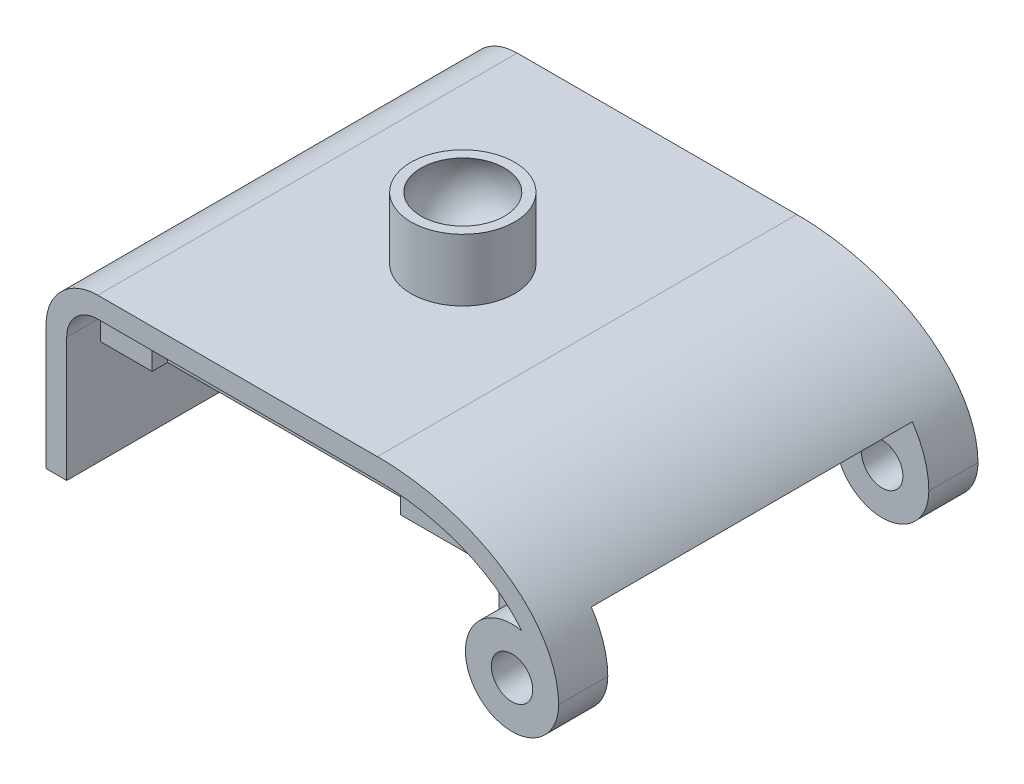
from build123d import *

# Parameters (mm, degrees)
EXTRUDE_1_DEPTH                 = 37.25
EXTRUDE_1_DEPTH_BACK            = 3.25
EXTRUDE_2_DEPTH                 = 34
SKETCH_4_W                      = 24
SKETCH_4_H                      = 3
CUT_EXTRUDE_2_DEPTH             = 1.5
SKETCH_5_W                      = 24
SKETCH_5_H                      = 3
CUT_EXTRUDE_3_DEPTH             = 1.5
CUT_EXTRUDE_4_DEPTH             = 1
SKETCH_8_R                      = 5
EXTRUDE_3_DEPTH                 = 6
CUT_EXTRUDE_5_REACH             = 60.218
CUT_EXTRUDE_5_DIRECTION_2_REACH = 60.218
CUT_EXTRUDE_START               = -40.5
SKETCH_11_R                     = 2
CUT_EXTRUDE_6_DEPTH             = 40.5
FILLET_1_R                      = 1


with BuildPart() as part:
    # 草图1 → 凸台-拉伸1 (new, two sides: drawn at the far end of the back side and taken through both)
    with BuildSketch(Plane.XY.offset(-EXTRUDE_1_DEPTH_BACK)):
        with BuildLine():
            Line((0, 0), (0, 12))
            ThreePointArc((0, 12), (1.464466094, 15.535533906), (5, 17))
            Line((5, 17), (32, 17))
            add(Edge.make_bspline(
                [(49.5, 5), (49.5, 17), (32, 17)],
                knots=[0, 0, 0, 1.570796327, 1.570796327, 1.570796327], degree=2, weights=[1, 0.707106781, 1]))
            ThreePointArc((49.5, 5), (41.509702911, 2.159608084), (45.914299452, 9.406138504))
            add(Edge.make_bspline(
                [(45.914299452, 9.406138504), (41.65859064, 15), (32, 15)],
                knots=[0.456282365, 0.456282365, 0.456282365, 1.570796327, 1.570796327, 1.570796327], degree=2, weights=[1, 0.848708976, 1]))
            Line((32, 15), (5, 15))
            ThreePointArc((5, 15), (2.878679656, 14.121320344), (2, 12))
            Line((2, 12), (2, 0))
            Line((2, 0), (0, 0))
        make_face()
    extrude(amount=EXTRUDE_1_DEPTH + EXTRUDE_1_DEPTH_BACK)

    # 草图3 → 凸台-拉伸2 (add)
    with BuildSketch(Plane.XY):
        with BuildLine():
            Line((2, 10), (2, 12))
            ThreePointArc((2, 12), (2.878679656, 14.121320344), (5, 15))
            Line((5, 15), (34, 15))
            Line((34, 15), (39.104860956, 15.703804603))
            Line((39.104860956, 15.703804603), (46.11459578, 11.473026606))
            Line((46.11459578, 11.473026606), (46.11459578, 10))
            Line((46.11459578, 10), (46.11459578, 5))
            Line((46.11459578, 5), (40.5, 5))
            Line((40.5, 5), (40.5, 9))
            Line((40.5, 9), (40.5, 10))
            Line((40.5, 10), (39.5, 10))
            Line((39.5, 10), (2, 10))
        make_face()
    extrude(amount=EXTRUDE_2_DEPTH)

    # 草图4 → 切除-拉伸2 (cut)
    with BuildSketch(Plane.XY):
        with Locations((19, 11.5)):
            Rectangle(SKETCH_4_W, SKETCH_4_H)
    extrude(amount=CUT_EXTRUDE_2_DEPTH, mode=Mode.SUBTRACT)

    # 草图5 → 切除-拉伸3 (cut)
    with BuildSketch(Plane.XY.offset(34)):
        with Locations((19, 11.5)):
            Rectangle(SKETCH_5_W, SKETCH_5_H)
    extrude(amount=-CUT_EXTRUDE_3_DEPTH, mode=Mode.SUBTRACT)

    # 草图6 → 切除-拉伸4 (cut)
    # profile 1 of 9: a face of its own
    with BuildSketch(Plane.ZY):
        with BuildLine():
            Line((17.062486682, 6.337097805), (17.127370552, 6.433304922))
            add(Edge.make_bspline(
                [(17.127370552, 6.433304922), (17.13666404, 6.4476645), (17.156985051, 6.479062953), (17.187800343, 6.531491014), (17.224095239, 6.592103365), (17.263951839, 6.661817271), (17.307836793, 6.740330668), (17.356736596, 6.827104586), (17.409285461, 6.922903534), (17.483990324, 7.060275708), (17.5751702, 7.23301731), (17.671287899, 7.438146499), (17.753388195, 7.634484637), (17.808981405, 7.792570319), (17.845884737, 7.910526564), (17.870704003, 7.986949933), (17.891449926, 8.053695194), (17.909468991, 8.110013034), (17.923576583, 8.156269858), (17.934395967, 8.192221734), (17.940903962, 8.218200076), (17.946868619, 8.242168486), (17.951829208, 8.274339562), (17.957926841, 8.323702425), (17.968429934, 8.391397351), (17.97475836, 8.442693711), (17.978318773, 8.471553377)],
                knots=[0, 0, 0, 0, 0.553378109, 1.210008858, 1.967352689, 2.839338893, 3.808124234, 4.877689115, 6.062102734, 7.343445452, 9.937410549, 12.380698025, 14.67067034, 16.820375242, 17.799754887, 18.669735412, 19.420213662, 20.061288848, 20.582887815, 20.985070831, 21.275757631, 21.449396392, 21.783958517, 22.327724234, 23.059166779, 24, 24, 24, 24], degree=3))
            Line((17.978318773, 8.471553377), (18.023812061, 8.471553377))
            Line((18.023812061, 8.471553377), (18.190123588, 8.048689538))
            add(Edge.make_bspline(
                [(18.190123588, 8.048689538), (18.171166424, 8.034993244), (18.137836461, 8.010912798), (18.1034282, 7.978719888), (18.085903374, 7.951817891), (18.072892568, 7.928698811), (18.054774603, 7.896496612), (18.032521209, 7.854661078), (18.005875067, 7.803344061), (17.974360379, 7.742784505), (17.938616992, 7.672650498), (17.885996928, 7.568197552), (17.819651705, 7.436177567), (17.742999384, 7.282706602), (17.669811963, 7.140313467), (17.611837328, 7.025968309), (17.5638027, 6.936076275), (17.522293896, 6.865231943), (17.476475125, 6.78880317), (17.422922979, 6.708680653), (17.364857543, 6.622840925), (17.30138362, 6.531722138), (17.232232126, 6.435589907), (17.183187006, 6.370561782), (17.157948008, 6.337097805)],
                knots=[0, 0, 0, 0, 0.769221431, 1.352423861, 1.529074247, 1.821788066, 2.22390053, 2.742661439, 3.378168602, 4.123215797, 4.985070903, 5.963759388, 7.96494763, 9.838323195, 11.598550095, 13.223702461, 14.049404432, 14.945770044, 15.92046477, 16.975859457, 18.110534635, 19.324695451, 20.623267581, 22, 22, 22, 22], degree=3))
            Line((17.157948008, 6.337097805), (17.107234179, 6.266993394))
            Line((17.107234179, 6.266993394), (17.062486682, 6.337097805))
        make_face()
    # profile 2 of 9: a face of its own
    with BuildSketch(Plane.ZY):
        with BuildLine():
            Line((17.968623482, 6.06040912), (18.003675687, 6.135734072))
            Line((18.003675687, 6.135734072), (18.08422118, 6.06040912))
            Line((18.08422118, 6.06040912), (18.375825698, 5.813552099))
            add(Edge.make_bspline(
                [(18.375825698, 5.813552099), (18.392736234, 5.798532725), (18.421573818, 5.772920143), (18.460367234, 5.744671715), (18.481394463, 5.72383136), (18.493603612, 5.719235288), (18.496643938, 5.718090773)],
                knots=[0, 0, 0, 0, 1.754127975, 2.991319391, 3.748818111, 4, 4, 4, 4], degree=3))
            add(Edge.make_bspline(
                [(18.496643938, 5.718090773), (18.49829884, 5.720771278), (18.504344137, 5.730563063), (18.503570649, 5.749330807), (18.505618619, 5.772277877), (18.509254101, 5.797574471), (18.51046535, 5.82903188), (18.515407648, 5.867408312), (18.517612894, 5.915723397), (18.521385386, 5.975835374), (18.521056581, 6.049230454), (18.521668928, 6.10242506), (18.522000852, 6.131259322)],
                knots=[0, 0, 0, 0, 0.225086146, 0.822231528, 1.290670906, 1.905653388, 2.6620565, 3.564727791, 4.698727915, 6.155571278, 7.916118279, 10, 10, 10, 10], degree=3))
            Line((18.522000852, 6.131259322), (18.522000852, 9.317281057))
            add(Edge.make_bspline(
                [(18.522000852, 9.317281057), (18.521772702, 9.360308256), (18.521326501, 9.444457869), (18.51211632, 9.565494158), (18.502558549, 9.673729954), (18.491976315, 9.755253473), (18.481751494, 9.815915893), (18.471004239, 9.864610815), (18.457587978, 9.919073775), (18.447026447, 9.957197036), (18.441455359, 9.977306627)],
                knots=[0, 0, 0, 0, 1.547346178, 3.026192341, 4.364546397, 5.456050829, 5.982389205, 6.577004877, 7.249386116, 8, 8, 8, 8], degree=3))
            Line((18.441455359, 9.977306627), (18.481728106, 10.022054123))
            Line((18.481728106, 10.022054123), (18.778553164, 9.614851907))
            add(Edge.make_bspline(
                [(18.778553164, 9.614851907), (18.76994435, 9.598278179), (18.754820538, 9.56916175), (18.73515032, 9.526183696), (18.720252804, 9.479434531), (18.707794781, 9.423123568), (18.694568032, 9.358863018), (18.685654104, 9.301583681), (18.681933061, 9.250445281), (18.679802032, 9.201702965), (18.678387574, 9.142275954), (18.678052366, 9.099013499), (18.677871298, 9.075644577)],
                knots=[0, 0, 0, 0, 1.009758074, 1.773924959, 2.551680179, 3.656752826, 4.890268125, 6.099082517, 6.786605503, 7.661107465, 8.736608971, 10, 10, 10, 10], degree=3))
            Line((18.677871298, 9.075644577), (18.677871298, 6))
            add(Edge.make_bspline(
                [(18.677871298, 6), (18.677583554, 5.953756509), (18.677048182, 5.867716554), (18.673294052, 5.748615615), (18.66815286, 5.648774469), (18.655971227, 5.543227571), (18.637661758, 5.427960925), (18.615339332, 5.322012265), (18.599502075, 5.248740809), (18.587132785, 5.210386667), (18.581324248, 5.187669424), (18.568951442, 5.172881506), (18.555296916, 5.185673257), (18.550247277, 5.194636596), (18.547357767, 5.199765608)],
                knots=[0, 0, 0, 0, 1.914653359, 3.562375758, 4.933851041, 6.052362095, 7.959530355, 9.766250594, 10.527741695, 11.07493174, 11.40751651, 11.545997894, 11.740210362, 12, 12, 12, 12], degree=3))
            Line((18.547357767, 5.199765608), (18.512305561, 5.26539527))
            Line((18.512305561, 5.26539527), (18.38626678, 5.471233752))
            Line((18.38626678, 5.471233752), (18.225175794, 5.723311315))
            Line((18.225175794, 5.723311315), (18.023812061, 5.990304709))
            Line((18.023812061, 5.990304709), (17.968623482, 6.06040912))
        make_face()
    # profile 3 of 9: a face of its own
    with BuildSketch(Plane.ZY):
        with BuildLine():
            Line((19.040326017, 8.36117622), (19.080598764, 8.416364799))
            Line((19.080598764, 8.416364799), (19.105955679, 8.381312593))
            Line((19.105955679, 8.381312593), (19.41322182, 7.953228212))
            Line((19.41322182, 7.953228212), (19.614585553, 7.641487322))
            Line((19.614585553, 7.641487322), (19.865917324, 7.218623482))
            Line((19.865917324, 7.218623482), (19.946462817, 7.072448327))
            Line((19.946462817, 7.072448327), (19.997176646, 6.966545919))
            add(Edge.make_bspline(
                [(19.997176646, 6.966545919), (20.002656756, 6.953712315), (20.012555882, 6.93053003), (20.02232865, 6.898525682), (20.029951686, 6.874656153), (20.033477966, 6.85025754), (20.029494993, 6.817893856), (20.025145305, 6.791482068), (20.022533561, 6.775623269)],
                knots=[0, 0, 0, 0, 1.271526692, 2.29685232, 3.050548467, 3.553977915, 4.531300672, 6, 6, 6, 6], degree=3))
            Line((20.022533561, 6.775623269), (19.991956105, 6.66450032))
            Line((19.991956105, 6.66450032), (19.951683358, 6.548902621))
            add(Edge.make_bspline(
                [(19.951683358, 6.548902621), (19.947774078, 6.536303646), (19.941083228, 6.514740125), (19.928922692, 6.488973609), (19.918570751, 6.471278218), (19.899666869, 6.46563194), (19.881289696, 6.485067673), (19.878187362, 6.503175242), (19.876358406, 6.513850416)],
                knots=[0, 0, 0, 0, 1.537433221, 2.631362767, 3.376993712, 3.828933445, 4.720064953, 6, 6, 6, 6], degree=3))
            Line((19.876358406, 6.513850416), (19.861442574, 6.574259535))
            add(Edge.make_bspline(
                [(19.861442574, 6.574259535), (19.858776512, 6.583975157), (19.852656441, 6.60627782), (19.84045768, 6.643504199), (19.824871536, 6.688779278), (19.805451451, 6.742076964), (19.781119798, 6.802862133), (19.754775591, 6.872614873), (19.723026565, 6.949562807), (19.689969052, 7.032900139), (19.654590406, 7.11683497), (19.621850359, 7.198435671), (19.58813095, 7.273305095), (19.558999816, 7.344036366), (19.5296632, 7.408349261), (19.502840554, 7.467639383), (19.477758046, 7.521233127), (19.431816514, 7.611881877), (19.369723801, 7.736464378), (19.290380952, 7.889082111), (19.220099259, 8.023390948), (19.165730662, 8.121948084), (19.128887297, 8.189663783), (19.108488412, 8.229689395), (19.09219796, 8.260458192), (19.084018894, 8.278363886), (19.080598764, 8.285851268)],
                knots=[0, 0, 0, 0, 0.384963827, 0.883702394, 1.496595004, 2.214914151, 3.05114879, 3.998553938, 5.064103531, 6.231973038, 7.424618756, 8.544919074, 9.591539058, 10.562049879, 11.467814365, 12.292583888, 13.049029966, 13.728809879, 16.176032318, 18.368524255, 20.302115207, 21.968637812, 22.669982638, 23.247858041, 23.685486984, 24, 24, 24, 24], degree=3))
            Line((19.080598764, 8.285851268), (19.040326017, 8.36117622))
        make_face()
    # profile 4 of 9: a face of its own
    with BuildSketch(Plane.ZY):
        with BuildLine():
            add(Edge.make_bspline(
                [(21.449978692, 7.93831238), (21.464912866, 7.91669968), (21.491997267, 7.877503201), (21.530639521, 7.820987793), (21.561223553, 7.76064135), (21.580496259, 7.68680228), (21.595634195, 7.597667195), (21.606737143, 7.494014299), (21.615530114, 7.379363384), (21.616032855, 7.299685239), (21.616290219, 7.258896228)],
                knots=[0, 0, 0, 0, 0.881232765, 1.598190978, 2.295533752, 3.137383339, 4.144986829, 5.328248715, 6.632271209, 8, 8, 8, 8], degree=3))
            Line((21.616290219, 7.258896228), (21.631206052, 6.790539101))
            add(Edge.make_bspline(
                [(21.631206052, 6.790539101), (21.63169389, 6.764460333), (21.632637341, 6.714025534), (21.634107737, 6.642915142), (21.642033138, 6.584320697), (21.651735147, 6.541720795), (21.673609298, 6.519726), (21.698670862, 6.509678041), (21.732417004, 6.504633474), (21.757970271, 6.50384641), (21.772160665, 6.503409333)],
                knots=[0, 0, 0, 0, 1.650852431, 3.192651296, 4.477622576, 5.427192863, 5.849578153, 6.384274066, 7.102745334, 8, 8, 8, 8], degree=3))
            add(Edge.make_bspline(
                [(21.772160665, 6.503409333), (21.786401658, 6.502729083), (21.813045088, 6.501456405), (21.851849421, 6.514163645), (21.883476167, 6.542749787), (21.905342802, 6.586612389), (21.92184427, 6.640905146), (21.931065153, 6.706618925), (21.940134285, 6.78396765), (21.945323272, 6.840240212), (21.948167483, 6.871084594)],
                knots=[0, 0, 0, 0, 0.741895998, 1.388010978, 2.079699508, 2.912679041, 3.92113713, 5.042206699, 6.378760387, 8, 8, 8, 8], degree=3))
            Line((21.948167483, 6.871084594), (21.973524398, 7.158214362))
            Line((21.973524398, 7.158214362), (22.039154059, 7.158214362))
            Line((22.039154059, 7.158214362), (22.039154059, 6.805454933))
            add(Edge.make_bspline(
                [(22.039154059, 6.805454933), (22.038866405, 6.772137258), (22.038335967, 6.710698976), (22.034681735, 6.626628715), (22.029447796, 6.558294153), (22.020597444, 6.504347585), (22.008485383, 6.460466935), (21.991277807, 6.424156846), (21.970289954, 6.392261349), (21.943830335, 6.367435603), (21.915360888, 6.34676254), (21.884173959, 6.331893617), (21.851360587, 6.32112024), (21.807163874, 6.315234498), (21.75696664, 6.313850579), (21.718456766, 6.316003054), (21.701310462, 6.316961432)],
                knots=[0, 0, 0, 0, 1.955595562, 3.606146949, 4.93917426, 5.975540879, 6.81139212, 7.601269519, 8.32576276, 9.0378047, 9.718034635, 10.383709129, 11.057491241, 11.736467872, 12.992175141, 14, 14, 14, 14], degree=3))
            add(Edge.make_bspline(
                [(21.701310462, 6.316961432), (21.689287657, 6.31797398), (21.666337527, 6.319906817), (21.634585352, 6.330270881), (21.606337792, 6.343519565), (21.58175815, 6.361826245), (21.561142717, 6.38584265), (21.544136133, 6.415642664), (21.529334145, 6.45100087), (21.516478224, 6.493171833), (21.505815727, 6.544523444), (21.499373805, 6.607228609), (21.493045311, 6.682046918), (21.491229463, 6.736079819), (21.490251438, 6.765182186)],
                knots=[0, 0, 0, 0, 0.785514098, 1.499454538, 2.167605402, 2.81714562, 3.484704239, 4.219933844, 5.049370252, 5.984178009, 7.095655963, 8.469322192, 10.098360771, 12, 12, 12, 12], degree=3))
            Line((21.490251438, 6.765182186), (21.485030897, 7.006818666))
            Line((21.485030897, 7.006818666), (21.479810356, 7.253675687))
            add(Edge.make_bspline(
                [(21.479810356, 7.253675687), (21.477964626, 7.286004102), (21.474042938, 7.354693461), (21.465158446, 7.458630386), (21.455513689, 7.559370106), (21.437924473, 7.647910777), (21.41191321, 7.722704724), (21.377567664, 7.786413259), (21.335197613, 7.839138791), (21.282108615, 7.875637585), (21.220071664, 7.896015675), (21.149374907, 7.907153389), (21.068648046, 7.911312955), (21.011696407, 7.90897143), (20.981621564, 7.907734924)],
                knots=[0, 0, 0, 0, 1.186982176, 2.522024164, 3.82431485, 4.894934829, 5.823070192, 6.716229133, 7.537699214, 8.278355097, 9.042196562, 9.911176558, 10.896940655, 12, 12, 12, 12], degree=3))
            Line((20.981621564, 7.907734924), (20.734764543, 7.887598551))
            Line((20.734764543, 7.887598551), (20.734764543, 6.699552525))
            add(Edge.make_bspline(
                [(20.734764543, 6.699552525), (20.732578757, 6.660519096), (20.728596507, 6.589404668), (20.722544142, 6.493721231), (20.717899943, 6.419384094), (20.714352193, 6.351505392), (20.709689305, 6.286494076), (20.702768459, 6.231825476), (20.695144766, 6.196271438), (20.691462407, 6.181347796), (20.68652267, 6.169411183), (20.681440217, 6.170962897), (20.679575964, 6.171532069)],
                knots=[0, 0, 0, 0, 2.178702561, 3.969346042, 5.343442504, 6.32866056, 7.759955515, 8.962971945, 9.43033784, 9.732921223, 9.902035012, 10, 10, 10, 10], degree=3))
            add(Edge.make_bspline(
                [(20.679575964, 6.171532069), (20.677316893, 6.172208342), (20.671749656, 6.173874943), (20.660737369, 6.180120449), (20.64878075, 6.19925571), (20.635582364, 6.227346662), (20.622944176, 6.259966807), (20.620306513, 6.2825798), (20.619166844, 6.292350309)],
                knots=[0, 0, 0, 0, 0.301236197, 0.742364128, 1.580669581, 3.100179862, 4.747060191, 6, 6, 6, 6], degree=3))
            Line((20.619166844, 6.292350309), (20.558757724, 6.473577669))
            add(Edge.make_bspline(
                [(20.558757724, 6.473577669), (20.553074912, 6.489987045), (20.543098167, 6.518795347), (20.529846277, 6.555837743), (20.522816714, 6.581108165), (20.519271322, 6.601470405), (20.527881835, 6.622053217), (20.54026558, 6.649596552), (20.554423315, 6.687305521), (20.566574064, 6.732584744), (20.57718867, 6.778585495), (20.584110634, 6.817456268), (20.586660324, 6.853682281), (20.59002595, 6.894396663), (20.591712997, 6.949641329), (20.593701563, 7.013781287), (20.596132406, 7.076167217), (20.596861169, 7.126167485), (20.599197212, 7.158198755), (20.599069561, 7.173626439), (20.599030471, 7.178350735)],
                knots=[0, 0, 0, 0, 1.301962309, 2.285725083, 2.940890519, 3.278257869, 3.802826989, 4.553745501, 5.567560366, 6.806006901, 8.066807115, 9.104973239, 9.759343731, 10.786589445, 12.166193442, 13.899498157, 15.595566675, 16.84419832, 17.646068083, 18, 18, 18, 18], degree=3))
            Line((20.599030471, 7.178350735), (20.599030471, 9.146494779))
            add(Edge.make_bspline(
                [(20.599030471, 9.146494779), (20.598686917, 9.161701456), (20.598029861, 9.190784654), (20.590704769, 9.232126436), (20.581482528, 9.26994353), (20.569652199, 9.291855867), (20.563978266, 9.302365225)],
                knots=[0, 0, 0, 0, 1.127954724, 2.157245254, 3.116197974, 4, 4, 4, 4], degree=3))
            Line((20.563978266, 9.302365225), (20.513264436, 9.377690177))
            add(Edge.make_bspline(
                [(20.513264436, 9.377690177), (20.50816823, 9.386792472), (20.49899895, 9.403169652), (20.488353893, 9.426308209), (20.484893335, 9.44491322), (20.483676144, 9.460676314), (20.495124312, 9.47209979), (20.514449663, 9.474563849), (20.54124836, 9.474544134), (20.56175925, 9.470832662), (20.573673556, 9.468676753)],
                knots=[0, 0, 0, 0, 1.380566717, 2.483966017, 3.320820912, 3.912566683, 4.446905125, 5.258929739, 6.407774973, 8, 8, 8, 8], degree=3))
            Line((20.573673556, 9.468676753), (20.679575964, 9.45823567))
            Line((20.679575964, 9.45823567), (20.785478372, 9.443319838))
            Line((20.785478372, 9.443319838), (20.981621564, 9.45823567))
            add(Edge.make_bspline(
                [(20.981621564, 9.45823567), (21.020395979, 9.460844873), (21.091462936, 9.465627102), (21.188710063, 9.470467013), (21.266522393, 9.474941024), (21.328089848, 9.478737734), (21.379977355, 9.479156893), (21.428145551, 9.470323997), (21.475359376, 9.455491935), (21.520851424, 9.433602996), (21.563689834, 9.406327559), (21.602776221, 9.374021312), (21.637608385, 9.337115706), (21.667800172, 9.2944074), (21.694593372, 9.245117264), (21.71555998, 9.186583252), (21.734429563, 9.119658289), (21.747683593, 9.043605335), (21.758836448, 8.960259403), (21.767049172, 8.870195787), (21.771324615, 8.773642009), (21.771875877, 8.707227521), (21.772160665, 8.672917111)],
                knots=[0, 0, 0, 0, 1.680330416, 3.079761997, 4.210278293, 5.049824392, 5.748610684, 6.446652486, 7.157163236, 7.883197757, 8.622714282, 9.348032282, 10.070477093, 10.810227951, 11.603784503, 12.488235885, 13.492302087, 14.607589106, 15.822258459, 17.128285687, 18.516442711, 20, 20, 20, 20], degree=3))
            add(Edge.make_bspline(
                [(21.772160665, 8.672917111), (21.771887417, 8.640098513), (21.771375816, 8.578652353), (21.767388377, 8.493239804), (21.759430224, 8.42097364), (21.744962649, 8.344331149), (21.720458195, 8.262013628), (21.68603043, 8.174247678), (21.647816067, 8.098004039), (21.612361575, 8.044268327), (21.583260877, 8.010206671), (21.564146572, 7.989984794), (21.544696875, 7.976267937), (21.531368202, 7.970684509), (21.525303644, 7.968144044)],
                knots=[0, 0, 0, 0, 1.521433389, 2.848575118, 3.962184411, 4.888901171, 6.460870269, 7.93539991, 9.254863418, 10.408771879, 10.907539274, 11.331296887, 11.695739513, 12, 12, 12, 12], degree=3))
            Line((21.525303644, 7.968144044), (21.449978692, 7.93831238))
        make_face()
        with BuildLine():
            Line((20.730289793, 8.074046452), (21.228478585, 8.094182825))
            add(Edge.make_bspline(
                [(21.228478585, 8.094182825), (21.248398028, 8.095344916), (21.286156787, 8.097547744), (21.339329135, 8.105725403), (21.385981346, 8.11729009), (21.437729258, 8.137828967), (21.491824737, 8.170964898), (21.534905593, 8.214746143), (21.561162337, 8.255922632), (21.57684195, 8.293040036), (21.592335524, 8.334842391), (21.603885599, 8.38423418), (21.614917021, 8.44283957), (21.621502614, 8.51420665), (21.626880355, 8.599004094), (21.628457107, 8.693784198), (21.628742179, 8.790113478), (21.622536246, 8.879975618), (21.61300864, 8.959416318), (21.601529054, 9.008100959), (21.596153846, 9.030897081)],
                knots=[0, 0, 0, 0, 0.918061632, 1.740252825, 2.473002692, 3.125389995, 4.297175273, 5.365424526, 5.921000699, 6.535663214, 7.216150394, 7.97108314, 8.866688876, 9.959840128, 11.266871048, 12.777820325, 14.322752802, 15.699036693, 16.922595727, 18, 18, 18, 18], degree=3))
            add(Edge.make_bspline(
                [(21.596153846, 9.030897081), (21.590302252, 9.05200445), (21.579328702, 9.0915873), (21.554773187, 9.144005625), (21.528933921, 9.187941009), (21.495924865, 9.220456434), (21.458717321, 9.244940736), (21.416237145, 9.263876551), (21.367275449, 9.27622942), (21.332456728, 9.280168497), (21.31424462, 9.282228851)],
                knots=[0, 0, 0, 0, 1.275305387, 2.391592206, 3.369358846, 4.230813774, 5.067494819, 5.95694154, 6.931367957, 8, 8, 8, 8], degree=3))
            add(Edge.make_bspline(
                [(21.31424462, 9.282228851), (21.308277718, 9.282267443), (21.293605535, 9.282362338), (21.267760824, 9.281295677), (21.233701055, 9.280649745), (21.191677242, 9.280116539), (21.141724112, 9.278280102), (21.083784655, 9.277111341), (21.017923014, 9.274570011), (20.971181809, 9.273236006), (20.946569359, 9.272533561)],
                knots=[0, 0, 0, 0, 0.389305479, 0.957274318, 1.687402304, 2.612145096, 3.699440328, 4.948883328, 6.393377747, 8, 8, 8, 8], degree=3))
            Line((20.946569359, 9.272533561), (20.734764543, 9.262092478))
            Line((20.734764543, 9.262092478), (20.730289793, 8.074046452))
        make_face(mode=Mode.SUBTRACT)
    # profile 5 of 9: a face of its own
    with BuildSketch(Plane.ZY):
        with BuildLine():
            Line((24.653153633, 7.238759855), (24.653153633, 9.171851694))
            add(Edge.make_bspline(
                [(24.653153633, 9.171851694), (24.652767199, 9.213876224), (24.651934242, 9.304460034), (24.644532999, 9.419018455), (24.637791039, 9.512199168), (24.633111708, 9.573698041), (24.62684971, 9.624115235), (24.620818685, 9.668075175), (24.609980449, 9.71401212), (24.598206976, 9.771570415), (24.578386903, 9.843704479), (24.565023734, 9.897228145), (24.557692308, 9.926592798)],
                knots=[0, 0, 0, 0, 1.65063593, 3.557943254, 4.50766379, 5.321080935, 5.980019612, 6.503456092, 7.062740995, 7.832795619, 8.811008151, 10, 10, 10, 10], degree=3))
            Line((24.557692308, 9.926592798), (24.597965054, 9.981781377))
            Line((24.597965054, 9.981781377), (24.87465374, 9.624547198))
            add(Edge.make_bspline(
                [(24.87465374, 9.624547198), (24.86871402, 9.611362298), (24.857974948, 9.587523865), (24.843070554, 9.555347181), (24.833724786, 9.529484831), (24.824416744, 9.502001334), (24.818653894, 9.463503782), (24.811829789, 9.421842668), (24.808507243, 9.384899595), (24.806121356, 9.360799624), (24.804683246, 9.342400273), (24.803518105, 9.326245302), (24.804079096, 9.305588398), (24.802701549, 9.27378328), (24.802300585, 9.227288502), (24.801545994, 9.170857743), (24.800876504, 9.113679141), (24.800287188, 9.064703144), (24.799201355, 9.028414994), (24.799292704, 9.008275117), (24.799328788, 9.000319625)],
                knots=[0, 0, 0, 0, 1.229141939, 2.222301064, 3.01107779, 3.565617067, 4.684312088, 6.306638596, 7.155903895, 7.834908721, 8.364752724, 8.724520035, 9.210424105, 10.119099074, 11.429097798, 13.161580252, 14.915187418, 16.288557072, 17.323959555, 18, 18, 18, 18], degree=3))
            Line((24.799328788, 9.000319625), (24.794108246, 7.283507351))
            add(Edge.make_bspline(
                [(24.794108246, 7.283507351), (24.819726892, 7.29117079), (24.868021899, 7.305617527), (24.936308199, 7.326754976), (24.996723947, 7.345381924), (25.049230608, 7.361610706), (25.093872756, 7.375629562), (25.129864311, 7.388690844), (25.15859179, 7.397833747), (25.198333111, 7.414141042), (25.254284591, 7.44541022), (25.295366333, 7.484046531), (25.317653953, 7.505007458)],
                knots=[0, 0, 0, 0, 1.394831347, 2.629467311, 3.728722758, 4.692598744, 5.496372274, 6.168932468, 6.68973394, 7.067797206, 8.409224694, 10, 10, 10, 10], degree=3))
            Line((25.317653953, 7.505007458), (25.478744939, 7.364052845))
            add(Edge.make_bspline(
                [(25.478744939, 7.364052845), (25.48671462, 7.355755625), (25.499704682, 7.342231697), (25.508757948, 7.317772412), (25.501468958, 7.298132827), (25.493043412, 7.288674681), (25.48844023, 7.283507351)],
                knots=[0, 0, 0, 0, 1.464781379, 2.38749828, 3.11903167, 4, 4, 4, 4], degree=3))
            Line((25.48844023, 7.283507351), (25.322874494, 7.243234605))
            Line((25.322874494, 7.243234605), (24.794108246, 7.097805242))
            Line((24.794108246, 7.097805242), (24.794108246, 5.677818027))
            add(Edge.make_bspline(
                [(24.794108246, 5.677818027), (24.794191087, 5.648234521), (24.794347722, 5.592298148), (24.793310097, 5.512998644), (24.792853129, 5.443134448), (24.791409148, 5.382219454), (24.789131158, 5.330510807), (24.786794147, 5.287773636), (24.785049121, 5.254353718), (24.781249695, 5.224026098), (24.775803311, 5.196421355), (24.769266792, 5.173938014), (24.76407119, 5.157070761), (24.756539091, 5.155011483), (24.7538355, 5.15427232)],
                knots=[0, 0, 0, 0, 2.000938193, 3.783365812, 5.364028275, 6.726426527, 7.904529436, 8.864288567, 9.622625463, 10.164880235, 10.936522302, 11.495465727, 11.818901144, 12, 12, 12, 12], degree=3))
            add(Edge.make_bspline(
                [(24.7538355, 5.15427232), (24.748821491, 5.156412552), (24.734930436, 5.162341956), (24.720967478, 5.189286364), (24.701717405, 5.22625075), (24.689849664, 5.257193249), (24.682985297, 5.27509056)],
                knots=[0, 0, 0, 0, 0.44712442, 1.238735474, 2.402869377, 4, 4, 4, 4], degree=3))
            Line((24.682985297, 5.27509056), (24.607660345, 5.471233752))
            add(Edge.make_bspline(
                [(24.607660345, 5.471233752), (24.60114514, 5.485662102), (24.590560352, 5.509102809), (24.580847048, 5.539084044), (24.583988449, 5.560915822), (24.588611138, 5.581191839), (24.595281615, 5.607668587), (24.609433461, 5.65215345), (24.628015304, 5.717603051), (24.63973014, 5.791368324), (24.646195842, 5.860470889), (24.650918058, 5.924353262), (24.652705393, 5.998995874), (24.652997862, 6.052205583), (24.653153633, 6.080545493)],
                knots=[0, 0, 0, 0, 0.923203971, 1.499863466, 1.77511809, 2.187685689, 2.708352362, 3.355567658, 4.893393802, 6.646140062, 7.674031107, 8.916086721, 10.357483463, 12, 12, 12, 12], degree=3))
            Line((24.653153633, 6.080545493), (24.653153633, 7.057532495))
            add(Edge.make_bspline(
                [(24.653153633, 7.057532495), (24.617853877, 7.046590568), (24.550484053, 7.025707826), (24.453959878, 6.995850275), (24.367068599, 6.968649763), (24.289976806, 6.942857123), (24.222308249, 6.920633493), (24.16400397, 6.901390656), (24.115443196, 6.884410375), (24.043623199, 6.856466398), (23.948876319, 6.817782457), (23.873320714, 6.772080259), (23.837257618, 6.750266354)],
                knots=[0, 0, 0, 0, 1.268098105, 2.420173863, 3.46691758, 4.392153921, 5.209491958, 5.910834308, 6.498981876, 6.974226894, 8.555782212, 10, 10, 10, 10], degree=3))
            Line((23.837257618, 6.750266354), (23.651555508, 6.880779885))
            add(Edge.make_bspline(
                [(23.651555508, 6.880779885), (23.644583061, 6.886209671), (23.631243635, 6.896597733), (23.619980006, 6.920254498), (23.629357465, 6.947258582), (23.646461863, 6.953409651), (23.656030258, 6.956850629)],
                knots=[0, 0, 0, 0, 1.030698152, 1.971893088, 2.865453963, 4, 4, 4, 4], degree=3))
            Line((23.656030258, 6.956850629), (23.953601108, 7.037396122))
            Line((23.953601108, 7.037396122), (24.653153633, 7.238759855))
        make_face()
    # profile 6 of 9: a face of its own
    with BuildSketch(Plane.ZY):
        with BuildLine():
            Line((23.943160026, 8.169507778), (23.978212231, 8.229916898))
            Line((23.978212231, 8.229916898), (24.204932879, 8.044214788))
            Line((24.204932879, 8.044214788), (24.340666951, 7.912955466))
            add(Edge.make_bspline(
                [(24.340666951, 7.912955466), (24.350307049, 7.90178439), (24.365839924, 7.883784685), (24.387432189, 7.85927066), (24.39707539, 7.828583371), (24.396783418, 7.806136763), (24.396601321, 7.792137226)],
                knots=[0, 0, 0, 0, 1.281524974, 2.06489265, 2.793109043, 4, 4, 4, 4], degree=3))
            Line((24.396601321, 7.792137226), (24.386160239, 7.585552951))
            add(Edge.make_bspline(
                [(24.386160239, 7.585552951), (24.385027851, 7.575110066), (24.383050112, 7.556871342), (24.37913558, 7.533013284), (24.373207891, 7.516866564), (24.364355067, 7.506868716), (24.352807794, 7.50709253), (24.343287571, 7.515933654), (24.333864794, 7.530475489), (24.328729272, 7.543150404), (24.325751119, 7.550500746)],
                knots=[0, 0, 0, 0, 1.749712821, 3.055911328, 4.001052877, 4.616028273, 5.112440934, 5.732956761, 6.685313235, 8, 8, 8, 8], degree=3))
            Line((24.325751119, 7.550500746), (24.290698913, 7.616130407))
            add(Edge.make_bspline(
                [(24.290698913, 7.616130407), (24.282143194, 7.633854168), (24.264107456, 7.67121644), (24.23260063, 7.728616679), (24.195475099, 7.790136944), (24.156088596, 7.857787756), (24.108617553, 7.928302514), (24.058911148, 8.005212877), (24.002247976, 8.085605514), (23.963293767, 8.14091876), (23.943160026, 8.169507778)],
                knots=[0, 0, 0, 0, 0.721896388, 1.521781365, 2.400778644, 3.357954283, 4.392505687, 5.51807539, 6.717200813, 8, 8, 8, 8], degree=3))
        make_face()
    # profile 7 of 9: a face of its own
    with BuildSketch(Plane.ZY):
        with BuildLine():
            Line((24.018484978, 9.357553804), (24.230289793, 9.171851694))
            Line((24.230289793, 9.171851694), (24.376464948, 9.020455998))
            add(Edge.make_bspline(
                [(24.376464948, 9.020455998), (24.386213393, 9.009089135), (24.402243915, 8.990397256), (24.421354146, 8.960477979), (24.424726109, 8.923124878), (24.422566855, 8.896316917), (24.421212444, 8.879501385)],
                knots=[0, 0, 0, 0, 1.162854479, 1.91221934, 2.690421055, 4, 4, 4, 4], degree=3))
            Line((24.421212444, 8.879501385), (24.406296612, 8.672917111))
            add(Edge.make_bspline(
                [(24.406296612, 8.672917111), (24.403952684, 8.659964359), (24.39954458, 8.635604794), (24.395788781, 8.611025599), (24.384622246, 8.590457354), (24.370558082, 8.602500646), (24.35923966, 8.619712376), (24.350947284, 8.637470463), (24.345887492, 8.648305988)],
                knots=[0, 0, 0, 0, 1.534781578, 2.88638368, 3.307588057, 3.719302256, 4.608377353, 6, 6, 6, 6], degree=3))
            Line((24.345887492, 8.648305988), (24.310835287, 8.728851481))
            add(Edge.make_bspline(
                [(24.310835287, 8.728851481), (24.287938396, 8.773468126), (24.240808331, 8.865305285), (24.163833935, 9.004494644), (24.079434137, 9.149401048), (24.019433794, 9.247050181), (23.988653313, 9.297144684)],
                knots=[0, 0, 0, 0, 0.920853951, 1.895449768, 2.920355025, 4, 4, 4, 4], degree=3))
            Line((23.988653313, 9.297144684), (24.018484978, 9.357553804))
        make_face()
    # profile 8 of 9: a face of its own
    with BuildSketch(Plane.ZY):
        with BuildLine():
            Line((22.4530684, 6.473577669), (22.493341146, 6.548902621))
            add(Edge.make_bspline(
                [(22.493341146, 6.548902621), (22.496863803, 6.55434589), (22.505715154, 6.568023145), (22.520044528, 6.593240799), (22.539937164, 6.626399904), (22.564036573, 6.667973331), (22.594473731, 6.717181873), (22.628422139, 6.775320919), (22.667146491, 6.841876089), (22.726196992, 6.941111103), (22.800900372, 7.072184033), (22.880631935, 7.236907417), (22.95495861, 7.404724286), (23.016738721, 7.576215973), (23.074061002, 7.74365478), (23.126781208, 7.902097206), (23.174979764, 8.0493726), (23.204204708, 8.144111458), (23.218250586, 8.189644151)],
                knots=[0, 0, 0, 0, 0.172753331, 0.434075811, 0.772653675, 1.203264885, 1.714533718, 2.314433772, 2.997301272, 3.766490209, 5.391873501, 7.015473716, 8.641302473, 10.280452243, 11.870580736, 13.357989456, 14.730216354, 16, 16, 16, 16], degree=3))
            add(Edge.make_bspline(
                [(23.218250586, 8.189644151), (23.163447566, 8.177932698), (23.059574073, 8.155734844), (22.913887978, 8.117051911), (22.786702701, 8.076422004), (22.710164834, 8.04374884), (22.674568506, 8.028553164)],
                knots=[0, 0, 0, 0, 1.183449989, 2.243107822, 3.182902371, 4, 4, 4, 4], degree=3))
            Line((22.674568506, 8.028553164), (22.503782229, 8.165033028))
            add(Edge.make_bspline(
                [(22.503782229, 8.165033028), (22.496631952, 8.170025603), (22.483659962, 8.179083103), (22.478106674, 8.203186449), (22.489391604, 8.22585775), (22.505019153, 8.231878646), (22.51347752, 8.235137439)],
                knots=[0, 0, 0, 0, 1.070350703, 1.941823655, 2.88601793, 4, 4, 4, 4], degree=3))
            Line((22.51347752, 8.235137439), (22.749893458, 8.275410185))
            Line((22.749893458, 8.275410185), (23.248828042, 8.366396761))
            Line((23.248828042, 8.366396761), (23.248828042, 9.232260814))
            add(Edge.make_bspline(
                [(23.248828042, 9.232260814), (23.209490007, 9.206608697), (23.132722699, 9.156549156), (23.036744299, 9.099775051), (22.965094171, 9.06163283), (22.921571512, 9.037355172), (22.885804441, 9.019590814), (22.86475907, 9.009736927), (22.855795866, 9.005540166)],
                knots=[0, 0, 0, 0, 1.861467703, 3.632613241, 4.417476939, 5.078870637, 5.607691888, 6, 6, 6, 6], degree=3))
            Line((22.855795866, 9.005540166), (22.734977626, 8.950351587))
            Line((22.734977626, 8.950351587), (22.669347965, 8.91455359))
            Line((22.669347965, 8.91455359), (22.654432133, 8.990624334))
            Line((22.654432133, 8.990624334), (22.709620712, 9.030897081))
            add(Edge.make_bspline(
                [(22.709620712, 9.030897081), (22.714842399, 9.033878243), (22.730507462, 9.04282173), (22.76166991, 9.060756052), (22.808715342, 9.086763965), (22.85804689, 9.113434075), (22.905404688, 9.140108297), (22.945319711, 9.167844277), (22.99029072, 9.197979548), (23.038530461, 9.23306702), (23.090351765, 9.272738545), (23.145053845, 9.317913181), (23.204934108, 9.365772059), (23.265716495, 9.417691419), (23.325221524, 9.468778054), (23.37860096, 9.517095956), (23.424899063, 9.560348345), (23.462184515, 9.599875525), (23.493815082, 9.633360551), (23.51661778, 9.662842586), (23.532962589, 9.687509063), (23.538196176, 9.703486049), (23.540432559, 9.710313232)],
                knots=[0, 0, 0, 0, 0.332835503, 0.99850651, 1.990257598, 3.308161477, 4.10356947, 4.996660843, 5.996683401, 7.100488107, 8.297778927, 9.608767652, 11.027224677, 12.540753003, 14.03336758, 15.368189861, 16.526491419, 17.538654158, 18.376384837, 19.072781213, 19.603786765, 20, 20, 20, 20], degree=3))
            Line((23.540432559, 9.710313232), (23.565789474, 9.790858726))
            Line((23.565789474, 9.790858726), (23.60606222, 9.800554017))
            Line((23.60606222, 9.800554017), (23.767153207, 9.614851907))
            add(Edge.make_bspline(
                [(23.767153207, 9.614851907), (23.77145159, 9.606562206), (23.779720802, 9.590614511), (23.786735522, 9.564157965), (23.777761906, 9.532785341), (23.758474176, 9.521107148), (23.747016834, 9.51417004)],
                knots=[0, 0, 0, 0, 0.941855546, 1.811938127, 2.70024244, 4, 4, 4, 4], degree=3))
            add(Edge.make_bspline(
                [(23.747016834, 9.51417004), (23.744549335, 9.512644742), (23.736877504, 9.507902355), (23.71986215, 9.500097803), (23.694227187, 9.486940913), (23.656629724, 9.471809078), (23.607727843, 9.446979877), (23.546274866, 9.40976421), (23.469669484, 9.361165843), (23.41474538, 9.32321882), (23.384562114, 9.302365225)],
                knots=[0, 0, 0, 0, 0.165414862, 0.514300234, 1.066209913, 1.809359511, 2.824298774, 4.191438585, 5.907024188, 8, 8, 8, 8], degree=3))
            Line((23.384562114, 9.302365225), (23.384562114, 8.391007884))
            add(Edge.make_bspline(
                [(23.384562114, 8.391007884), (23.409988172, 8.396964213), (23.458560662, 8.408342843), (23.526968422, 8.428672333), (23.589396743, 8.445640741), (23.644051385, 8.464734697), (23.692575105, 8.481957753), (23.732998068, 8.501268244), (23.768317427, 8.517500531), (23.787930506, 8.530966488), (23.796984871, 8.537183039)],
                knots=[0, 0, 0, 0, 1.4253629, 2.722931955, 3.895592432, 4.95571943, 5.883422084, 6.703403132, 7.401426915, 8, 8, 8, 8], degree=3))
            Line((23.796984871, 8.537183039), (23.937939484, 8.396228425))
            add(Edge.make_bspline(
                [(23.937939484, 8.396228425), (23.942366783, 8.390281256), (23.950174959, 8.379792572), (23.958545851, 8.361463302), (23.947534571, 8.340514411), (23.932683803, 8.334506682), (23.923023652, 8.330598764)],
                knots=[0, 0, 0, 0, 1.041890506, 1.837523138, 2.593348605, 4, 4, 4, 4], degree=3))
            Line((23.923023652, 8.330598764), (23.736575751, 8.295546559))
            Line((23.736575751, 8.295546559), (23.379341573, 8.225442148))
            Line((23.379341573, 8.225442148), (23.379341573, 7.953228212))
            Line((23.379341573, 7.953228212), (23.535212018, 7.857766887))
            Line((23.535212018, 7.857766887), (23.66647134, 7.75708502))
            add(Edge.make_bspline(
                [(23.66647134, 7.75708502), (23.676966676, 7.748698012), (23.695446521, 7.73393044), (23.719167587, 7.713640939), (23.735046809, 7.6979542), (23.747616946, 7.67971294), (23.754861349, 7.64866895), (23.759197629, 7.622312941), (23.761932666, 7.605689325)],
                knots=[0, 0, 0, 0, 1.289132826, 2.269863128, 2.995429436, 3.425508124, 4.376181849, 6, 6, 6, 6], degree=3))
            Line((23.761932666, 7.605689325), (23.776848498, 7.329000639))
            add(Edge.make_bspline(
                [(23.776848498, 7.329000639), (23.776592627, 7.325264688), (23.775774055, 7.313312799), (23.774782579, 7.293762324), (23.772872726, 7.2708083), (23.754748638, 7.257900132), (23.734461333, 7.267271848), (23.729710741, 7.280717388), (23.72688046, 7.288727893)],
                knots=[0, 0, 0, 0, 0.570253537, 1.824329516, 3.038768503, 3.89119994, 4.743631376, 6, 6, 6, 6], degree=3))
            Line((23.72688046, 7.288727893), (23.691828255, 7.369273386))
            add(Edge.make_bspline(
                [(23.691828255, 7.369273386), (23.672833067, 7.406190196), (23.633505528, 7.482622569), (23.559576847, 7.593860243), (23.475814978, 7.709304148), (23.412188274, 7.784101326), (23.379341573, 7.822714681)],
                knots=[0, 0, 0, 0, 0.901632331, 1.866734905, 2.89872149, 4, 4, 4, 4], degree=3))
            Line((23.379341573, 7.822714681), (23.374121031, 5.859045387))
            add(Edge.make_bspline(
                [(23.374121031, 5.859045387), (23.373447641, 5.821008502), (23.372175537, 5.749152932), (23.369284834, 5.64771558), (23.365453123, 5.558973641), (23.361692201, 5.482909804), (23.358327233, 5.41870948), (23.353572483, 5.366068079), (23.349791919, 5.324100313), (23.34418193, 5.29294908), (23.339656719, 5.270119142), (23.332980969, 5.255368315), (23.324624117, 5.244571224), (23.317129326, 5.245043536), (23.313711911, 5.245258896)],
                knots=[0, 0, 0, 0, 2.175565076, 4.10986515, 5.803138821, 7.254977998, 8.465481865, 9.478461605, 10.27915043, 10.870467245, 11.294590593, 11.593478479, 11.814637602, 12, 12, 12, 12], degree=3))
            add(Edge.make_bspline(
                [(23.313711911, 5.245258896), (23.308927353, 5.247673871), (23.295390756, 5.25450638), (23.283297764, 5.283280332), (23.265291187, 5.322956775), (23.254875774, 5.356370609), (23.248828042, 5.375772427)],
                knots=[0, 0, 0, 0, 0.422644614, 1.195757091, 2.371710043, 4, 4, 4, 4], degree=3))
            Line((23.248828042, 5.375772427), (23.168282548, 5.632324739))
            add(Edge.make_bspline(
                [(23.168282548, 5.632324739), (23.164088413, 5.642555646), (23.157152486, 5.659474706), (23.153294383, 5.682532772), (23.158506041, 5.700335361), (23.164523004, 5.71956835), (23.17255582, 5.745842995), (23.188322993, 5.790215765), (23.207607269, 5.853256245), (23.21928475, 5.922678166), (23.227045584, 5.984988993), (23.232334911, 6.041930682), (23.235712989, 6.108364635), (23.237456318, 6.1558684), (23.238386959, 6.18122736)],
                knots=[0, 0, 0, 0, 0.711903788, 1.177289854, 1.456064859, 1.890294807, 2.475929022, 3.217975821, 4.915124877, 6.699798969, 7.729356401, 8.947649762, 10.370562256, 12, 12, 12, 12], degree=3))
            Line((23.238386959, 6.18122736), (23.243607501, 7.75708502))
            add(Edge.make_bspline(
                [(23.243607501, 7.75708502), (23.224385699, 7.710774299), (23.186942946, 7.620564183), (23.129692648, 7.490550395), (23.073694109, 7.369487129), (23.019295781, 7.257569217), (22.966632933, 7.154706275), (22.914927597, 7.060925815), (22.864688323, 6.976187389), (22.815319241, 6.900709015), (22.768251791, 6.834326742), (22.728910329, 6.773447355), (22.692250733, 6.721659766), (22.662879881, 6.67577269), (22.637501291, 6.637920893), (22.617080635, 6.607678856), (22.603088847, 6.584127723), (22.586679885, 6.558197326), (22.571471591, 6.53035775), (22.55496012, 6.510962727), (22.548529725, 6.503409333)],
                knots=[0, 0, 0, 0, 1.883267637, 3.668476461, 5.33536204, 6.893013805, 8.34210226, 9.675278549, 10.914715739, 12.041284001, 13.061745135, 13.970730753, 14.763247454, 15.444358934, 16.016683212, 16.47506789, 16.814565951, 17.045180387, 17.628145396, 18, 18, 18, 18], degree=3))
            Line((22.548529725, 6.503409333), (22.478425314, 6.42286384))
            Line((22.478425314, 6.42286384), (22.4530684, 6.473577669))
        make_face()
    # profile 9 of 9: a face of its own
    with BuildSketch(Plane.ZY):
        with BuildLine():
            Line((26.770455998, 7.530364372), (26.770455998, 8.290326017))
            Line((26.770455998, 8.290326017), (26.624280844, 8.255273812))
            Line((26.624280844, 8.255273812), (26.498242063, 8.220221607))
            Line((26.498242063, 8.220221607), (26.3528127, 8.169507778))
            Line((26.3528127, 8.169507778), (26.272267206, 8.139676113))
            Line((26.272267206, 8.139676113), (26.226773919, 8.185169401))
            Line((26.226773919, 8.185169401), (26.131312593, 8.270189644))
            add(Edge.make_bspline(
                [(26.131312593, 8.270189644), (26.124209325, 8.275180921), (26.111730096, 8.283949741), (26.105723138, 8.305831357), (26.115362875, 8.325429394), (26.12867393, 8.328798381), (26.135787343, 8.330598764)],
                knots=[0, 0, 0, 0, 1.207752163, 2.121814152, 2.996299639, 4, 4, 4, 4], degree=3))
            Line((26.135787343, 8.330598764), (26.367728532, 8.370871511))
            Line((26.367728532, 8.370871511), (26.558651183, 8.411144257))
            Line((26.558651183, 8.411144257), (26.770455998, 8.467078628))
            Line((26.770455998, 8.467078628), (26.770455998, 9.417962924))
            add(Edge.make_bspline(
                [(26.770455998, 9.417962924), (26.770349882, 9.457005884), (26.770137521, 9.535139288), (26.764051706, 9.63176714), (26.760038023, 9.70570032), (26.754261951, 9.754339574), (26.749527645, 9.796215801), (26.742888754, 9.834215776), (26.734667932, 9.874140429), (26.724955559, 9.922116718), (26.713014679, 9.981032436), (26.704326416, 10.024042335), (26.699605796, 10.047411038)],
                knots=[0, 0, 0, 0, 1.843580815, 3.689403703, 4.571978489, 5.33959543, 6.002242086, 6.562034502, 7.160740992, 7.927549301, 8.8739689, 10, 10, 10, 10], degree=3))
            Line((26.699605796, 10.047411038), (26.735403793, 10.082463243))
            Line((26.735403793, 10.082463243), (26.96659919, 9.770722352))
            add(Edge.make_bspline(
                [(26.96659919, 9.770722352), (26.961353739, 9.755815185), (26.951672329, 9.728301369), (26.938658592, 9.690196334), (26.929404654, 9.658136566), (26.922074008, 9.620802909), (26.916620535, 9.570693202), (26.910915857, 9.505061684), (26.907397461, 9.435647191), (26.906576114, 9.389625599), (26.90619007, 9.367994886)],
                knots=[0, 0, 0, 0, 0.925118474, 1.707469848, 2.35716044, 2.876603134, 3.932574437, 5.305502973, 6.733553329, 8, 8, 8, 8], degree=3))
            Line((26.90619007, 9.367994886), (26.90619007, 8.502130833))
            add(Edge.make_bspline(
                [(26.90619007, 8.502130833), (26.938156449, 8.510854569), (26.999045286, 8.527471345), (27.084155959, 8.558730968), (27.158564737, 8.594851881), (27.202296344, 8.623975939), (27.223151502, 8.637864905)],
                knots=[0, 0, 0, 0, 1.14625621, 2.183362963, 3.133664289, 4, 4, 4, 4], degree=3))
            Line((27.223151502, 8.637864905), (27.339494993, 8.537183039))
            Line((27.339494993, 8.537183039), (27.444651609, 8.552098871))
            Line((27.444651609, 8.552098871), (27.57069039, 8.572235244))
            Line((27.57069039, 8.572235244), (27.772054123, 8.612507991))
            Line((27.772054123, 8.612507991), (27.938365651, 8.652780737))
            Line((27.938365651, 8.652780737), (27.953281483, 9.473897294))
            Line((27.953281483, 9.473897294), (27.953281483, 9.538781163))
            add(Edge.make_bspline(
                [(27.953281483, 9.538781163), (27.953375589, 9.546987159), (27.953592449, 9.565897374), (27.951382011, 9.598430466), (27.95040725, 9.638979645), (27.948885419, 9.668800415), (27.948060942, 9.684956318)],
                knots=[0, 0, 0, 0, 0.6729474, 1.550766224, 2.673086519, 4, 4, 4, 4], degree=3))
            add(Edge.make_bspline(
                [(27.948060942, 9.684956318), (27.945845465, 9.704349668), (27.941726064, 9.740409161), (27.935791548, 9.78960375), (27.930989764, 9.829847022), (27.92809097, 9.863737426), (27.924227893, 9.897707017), (27.916233107, 9.936893873), (27.905881537, 9.984646858), (27.89743796, 10.019091107), (27.892872363, 10.037715747)],
                knots=[0, 0, 0, 0, 1.310252018, 2.43624873, 3.326329528, 4.030371091, 4.719622734, 5.619659308, 6.712905954, 8, 8, 8, 8], degree=3))
            Line((27.892872363, 10.037715747), (27.93314511, 10.087683784))
            Line((27.93314511, 10.087683784), (28.185222672, 9.790858726))
            add(Edge.make_bspline(
                [(28.185222672, 9.790858726), (28.17463057, 9.763161543), (28.155352893, 9.71275254), (28.133657045, 9.639249549), (28.121003218, 9.56840631), (28.112049718, 9.505194228), (28.108693665, 9.441853319), (28.106554071, 9.374972856), (28.105187655, 9.289691007), (28.104857722, 9.22654331), (28.104677179, 9.191988067)],
                knots=[0, 0, 0, 0, 1.168277189, 2.126269992, 3.013816946, 4.001593886, 4.639495785, 5.511776665, 6.63841174, 8, 8, 8, 8], degree=3))
            Line((28.104677179, 9.191988067), (28.089015555, 8.683358193))
            Line((28.089015555, 8.683358193), (28.376145323, 8.753462604))
            add(Edge.make_bspline(
                [(28.376145323, 8.753462604), (28.41687778, 8.763707428), (28.494465762, 8.783221969), (28.602131812, 8.821922231), (28.697301793, 8.86298787), (28.752637328, 8.897968645), (28.778872789, 8.91455359)],
                knots=[0, 0, 0, 0, 1.155268313, 2.200577704, 3.146865112, 4, 4, 4, 4], degree=3))
            Line((28.778872789, 8.91455359), (28.925047944, 8.763903686))
            add(Edge.make_bspline(
                [(28.925047944, 8.763903686), (28.931855449, 8.753932277), (28.943208726, 8.737302373), (28.954323114, 8.710379298), (28.939234044, 8.686153299), (28.921333043, 8.684433991), (28.910132112, 8.683358193)],
                knots=[0, 0, 0, 0, 1.311508504, 2.187279676, 2.865753018, 4, 4, 4, 4], degree=3))
            Line((28.910132112, 8.683358193), (28.572288515, 8.617728532))
            Line((28.572288515, 8.617728532), (28.079320264, 8.507351374))
            Line((28.079320264, 8.507351374), (28.068879182, 7.822714681))
            Line((28.068879182, 7.822714681), (28.356008949, 7.898039633))
            Line((28.356008949, 7.898039633), (28.426859152, 8.044214788))
            add(Edge.make_bspline(
                [(28.426859152, 8.044214788), (28.430562181, 8.052177928), (28.436983423, 8.065986419), (28.445334889, 8.083223656), (28.452185924, 8.093137312), (28.462333109, 8.098936665), (28.476791304, 8.082592302), (28.488901497, 8.074327802), (28.496963563, 8.068825911)],
                knots=[0, 0, 0, 0, 1.445259766, 2.506154333, 3.144946536, 3.41927505, 4.281945057, 6, 6, 6, 6], degree=3))
            Line((28.496963563, 8.068825911), (28.628222885, 7.918176007))
            add(Edge.make_bspline(
                [(28.628222885, 7.918176007), (28.633512372, 7.909428792), (28.642174078, 7.895104942), (28.653104722, 7.873598271), (28.645603403, 7.851003662), (28.634891542, 7.839544106), (28.628222885, 7.832409972)],
                knots=[0, 0, 0, 0, 1.270434307, 2.080377676, 2.804941301, 4, 4, 4, 4], degree=3))
            add(Edge.make_bspline(
                [(28.628222885, 7.832409972), (28.614361152, 7.81565749), (28.588228598, 7.784075209), (28.554475498, 7.737606972), (28.529307482, 7.694582445), (28.513738379, 7.659672363), (28.503410953, 7.629219782), (28.494675241, 7.599559689), (28.4844088, 7.562150182), (28.471521289, 7.517212747), (28.456805534, 7.464453684), (28.439467202, 7.404166633), (28.420851181, 7.33628745), (28.401146061, 7.261210184), (28.37843835, 7.180118915), (28.35047188, 7.094508765), (28.319191822, 7.004233935), (28.284008369, 6.909546769), (28.245344605, 6.810189025), (28.202014879, 6.706880186), (28.154757805, 6.599096383), (28.121658753, 6.525997247), (28.104677179, 6.488493501)],
                knots=[0, 0, 0, 0, 0.899299023, 1.695385343, 2.372631525, 2.957293223, 3.27271858, 3.702131425, 4.236033656, 4.877273888, 5.635748685, 6.501563293, 7.471946197, 8.546954633, 9.712201984, 10.954394654, 12.27140719, 13.66385131, 15.132244464, 16.680958317, 18.297155035, 20, 20, 20, 20], degree=3))
            add(Edge.make_bspline(
                [(28.104677179, 6.488493501), (28.130407961, 6.443675831), (28.179679637, 6.35785482), (28.252285509, 6.235886305), (28.322602065, 6.127709796), (28.388586346, 6.032310344), (28.450609793, 5.949819306), (28.508286427, 5.879824767), (28.563451548, 5.823706327), (28.630507173, 5.766248504), (28.71465222, 5.711112307), (28.817079221, 5.658362378), (28.92251362, 5.619173144), (28.994907822, 5.604551925), (29.030950352, 5.597272534)],
                knots=[0, 0, 0, 0, 1.392621228, 2.666719691, 3.824331374, 4.868711359, 5.791839041, 6.604962184, 7.310778639, 7.909506896, 8.98155807, 10.012183092, 11.010335815, 12, 12, 12, 12], degree=3))
            Line((29.030950352, 5.597272534), (29.141327509, 5.582356701))
            Line((29.141327509, 5.582356701), (29.20695717, 5.571915619))
            Line((29.20695717, 5.571915619), (29.216652461, 5.481674835))
            Line((29.216652461, 5.481674835), (28.552152141, 5.360856595))
            Line((28.552152141, 5.360856595), (28.431333902, 5.571915619))
            Line((28.431333902, 5.571915619), (28.129288302, 6.12081824))
            Line((28.129288302, 6.12081824), (28.018911144, 6.316961432))
            add(Edge.make_bspline(
                [(28.018911144, 6.316961432), (27.995371287, 6.278629874), (27.95154633, 6.207266704), (27.889467475, 6.108678672), (27.836715155, 6.026015985), (27.797444573, 5.965908442), (27.76650527, 5.922133576), (27.74029805, 5.887147651), (27.709903558, 5.847714382), (27.674743969, 5.804529761), (27.635036516, 5.757226074), (27.590189835, 5.706278821), (27.54197569, 5.650148736), (27.472253721, 5.571303622), (27.380675485, 5.475532256), (27.267678867, 5.368331944), (27.151807109, 5.273139837), (27.071616732, 5.21693245), (27.032228851, 5.189324526)],
                knots=[0, 0, 0, 0, 1.429315196, 2.661004914, 3.701839984, 4.545315653, 4.942008694, 5.404903371, 5.934207415, 6.523901216, 7.17422977, 7.896519023, 8.680490309, 9.525407281, 11.240621167, 12.889129241, 14.472003616, 16, 16, 16, 16], degree=3))
            Line((27.032228851, 5.189324526), (26.971819732, 5.149051779))
            Line((26.971819732, 5.149051779), (26.946462817, 5.219901982))
            Line((26.946462817, 5.219901982), (26.986735564, 5.260174728))
            Line((26.986735564, 5.260174728), (27.132910718, 5.390688259))
            add(Edge.make_bspline(
                [(27.132910718, 5.390688259), (27.17387281, 5.430029348), (27.255574972, 5.50849829), (27.370000638, 5.633720292), (27.479332673, 5.762811937), (27.582349555, 5.897052713), (27.678510965, 6.03655529), (27.767914004, 6.180893617), (27.852107813, 6.329404081), (27.902563989, 6.431804075), (27.927924569, 6.48327296)],
                knots=[0, 0, 0, 0, 1.002702335, 1.999969825, 2.993752723, 3.989463334, 4.986779135, 5.984471684, 6.986943349, 8, 8, 8, 8], degree=3))
            Line((27.927924569, 6.48327296), (27.766833582, 6.790539101))
            add(Edge.make_bspline(
                [(27.766833582, 6.790539101), (27.74896294, 6.823616582), (27.716229673, 6.884203888), (27.671293526, 6.966466525), (27.633197956, 7.030307918), (27.601590567, 7.081516217), (27.569172856, 7.127437857), (27.527863545, 7.1747341), (27.478216267, 7.23023407), (27.440376328, 7.268280876), (27.420040486, 7.288727893)],
                knots=[0, 0, 0, 0, 1.478007093, 2.707233604, 3.684357871, 4.400171258, 5.072715409, 5.891059417, 6.866618563, 8, 8, 8, 8], degree=3))
            Line((27.420040486, 7.288727893), (27.429735777, 7.349137013))
            Line((27.429735777, 7.349137013), (27.605742595, 7.323780098))
            add(Edge.make_bspline(
                [(27.605742595, 7.323780098), (27.619056036, 7.321029108), (27.639659577, 7.316771746), (27.664649818, 7.307766138), (27.673535995, 7.292586154), (27.680797126, 7.275886518), (27.68966029, 7.251132717), (27.69945261, 7.218048301), (27.714343218, 7.177598704), (27.736709838, 7.130727891), (27.764142864, 7.076038036), (27.785788739, 7.037794053), (27.797411038, 7.017259749)],
                knots=[0, 0, 0, 0, 1.090126887, 1.687052664, 1.97011438, 2.4444174, 3.133594766, 4.039834432, 5.17003814, 6.531238343, 8.137521253, 10, 10, 10, 10], degree=3))
            Line((27.797411038, 7.017259749), (28.008470062, 6.644363946))
            add(Edge.make_bspline(
                [(28.008470062, 6.644363946), (28.019478672, 6.670437784), (28.040722563, 6.720753833), (28.070414671, 6.794248578), (28.098479919, 6.862487799), (28.12206908, 6.926934921), (28.143471647, 6.986424257), (28.163546148, 7.040725326), (28.178688767, 7.090791739), (28.197737222, 7.153180846), (28.219294081, 7.235778326), (28.2483828, 7.344158606), (28.281549742, 7.467556588), (28.303902768, 7.554949678), (28.315736203, 7.601214575)],
                knots=[0, 0, 0, 0, 1.012283211, 1.953455926, 2.835165991, 3.651069543, 4.407696922, 5.096728752, 5.7210473, 6.278037146, 7.429875929, 8.77357589, 10.291968163, 12, 12, 12, 12], degree=3))
            Line((28.315736203, 7.601214575), (28.346313659, 7.726507564))
            Line((28.346313659, 7.726507564), (28.074099723, 7.666098444))
            Line((28.074099723, 7.666098444), (27.817547411, 7.595994034))
            Line((27.817547411, 7.595994034), (27.605742595, 7.535584914))
            Line((27.605742595, 7.535584914), (27.505060729, 7.495312167))
            add(Edge.make_bspline(
                [(27.505060729, 7.495312167), (27.501756122, 7.49771945), (27.490319389, 7.506050687), (27.48150007, 7.517209395), (27.475229065, 7.525143831)],
                knots=[0, 0, 0, 0, 0.577893415, 2, 2, 2, 2], degree=3))
            Line((27.475229065, 7.525143831), (27.369326657, 7.63626678))
            add(Edge.make_bspline(
                [(27.369326657, 7.63626678), (27.366466834, 7.639829409), (27.360689906, 7.647026027), (27.354021381, 7.661534552), (27.365700266, 7.680228574), (27.380244682, 7.683904801), (27.38946303, 7.686234818)],
                knots=[0, 0, 0, 0, 0.773373508, 1.562238153, 2.45493028, 4, 4, 4, 4], degree=3))
            Line((27.38946303, 7.686234818), (27.636320051, 7.731728106))
            Line((27.636320051, 7.731728106), (27.918229278, 7.792137226))
            Line((27.918229278, 7.792137226), (27.927924569, 8.476773919))
            add(Edge.make_bspline(
                [(27.927924569, 8.476773919), (27.901823593, 8.469806727), (27.851602015, 8.456400969), (27.779148703, 8.437171878), (27.712966383, 8.418690887), (27.653389137, 8.400728461), (27.60003255, 8.384021308), (27.552577713, 8.369550039), (27.51145916, 8.355557515), (27.486629314, 8.345608011), (27.475229065, 8.341039847)],
                knots=[0, 0, 0, 0, 1.371158585, 2.63828247, 3.804722916, 4.858586413, 5.796466396, 6.642512982, 7.376730264, 8, 8, 8, 8], degree=3))
            Line((27.475229065, 8.341039847), (27.374547198, 8.451417004))
            add(Edge.make_bspline(
                [(27.374547198, 8.451417004), (27.372161173, 8.44639157), (27.368914854, 8.43955419), (27.365113497, 8.433013857), (27.364106115, 8.431280631)],
                knots=[0, 0, 0, 0, 1.469988213, 2, 2, 2, 2], degree=3))
            Line((27.364106115, 8.431280631), (27.319358619, 8.426805881))
            Line((27.319358619, 8.426805881), (27.258949499, 8.416364799))
            add(Edge.make_bspline(
                [(27.258949499, 8.416364799), (27.254239151, 8.414827507), (27.238806824, 8.409790939), (27.205993422, 8.402411603), (27.155356544, 8.390224452), (27.115525666, 8.381249345), (27.092637971, 8.376092052)],
                knots=[0, 0, 0, 0, 0.34727071, 1.137749183, 2.355287991, 4, 4, 4, 4], degree=3))
            Line((27.092637971, 8.376092052), (26.90619007, 8.330598764))
            Line((26.90619007, 8.330598764), (26.911410612, 7.631046239))
            Line((26.911410612, 7.631046239), (27.273865331, 7.923396548))
            Line((27.273865331, 7.923396548), (27.32905391, 7.973364586))
            Line((27.32905391, 7.973364586), (27.364106115, 7.892819092))
            Line((27.364106115, 7.892819092), (27.314138078, 7.842851055))
            Line((27.314138078, 7.842851055), (26.911410612, 7.460259962))
            Line((26.911410612, 7.460259962), (26.90619007, 5.979863627))
            add(Edge.make_bspline(
                [(26.90619007, 5.979863627), (26.905956651, 5.960970579), (26.905459051, 5.920694628), (26.904332189, 5.856267842), (26.900010913, 5.784462189), (26.894297891, 5.677505872), (26.884016981, 5.535508316), (26.872703905, 5.405763894), (26.864136679, 5.320508578), (26.85936299, 5.284274815), (26.852292649, 5.25457253), (26.846082764, 5.230412352), (26.838683967, 5.212232192), (26.831162856, 5.199488177), (26.820826888, 5.192471967), (26.814022869, 5.193868799), (26.810728745, 5.194545067)],
                knots=[0, 0, 0, 0, 0.981428655, 2.092196784, 3.346364121, 4.717271267, 7.655661965, 10.740757043, 11.480831197, 12.107183262, 12.636592368, 13.065821005, 13.401543852, 13.652257644, 13.831642677, 14, 14, 14, 14], degree=3))
            add(Edge.make_bspline(
                [(26.810728745, 5.194545067), (26.808114813, 5.196157764), (26.799798918, 5.201288353), (26.790554811, 5.220069235), (26.773214605, 5.245670525), (26.761984893, 5.267679919), (26.755540166, 5.280311102)],
                knots=[0, 0, 0, 0, 0.354203481, 1.126853481, 2.351102295, 4, 4, 4, 4], degree=3))
            Line((26.755540166, 5.280311102), (26.669774132, 5.426486256))
            Line((26.669774132, 5.426486256), (26.488546772, 5.723311315))
            Line((26.488546772, 5.723311315), (26.322235244, 5.979863627))
            Line((26.322235244, 5.979863627), (26.296878329, 6.005220541))
            Line((26.296878329, 6.005220541), (26.342371617, 6.070850202))
            Line((26.342371617, 6.070850202), (26.402780737, 6.005220541))
            Line((26.402780737, 6.005220541), (26.508683145, 5.899318133))
            Line((26.508683145, 5.899318133), (26.629501385, 5.783720435))
            add(Edge.make_bspline(
                [(26.629501385, 5.783720435), (26.642486334, 5.770297183), (26.664910903, 5.74711568), (26.694865746, 5.721089299), (26.712141045, 5.703199674), (26.722166592, 5.699098277), (26.72496271, 5.6979544)],
                knots=[0, 0, 0, 0, 1.735373039, 2.996930619, 3.720244646, 4, 4, 4, 4], degree=3))
            add(Edge.make_bspline(
                [(26.72496271, 5.6979544), (26.727344159, 5.699827986), (26.734590071, 5.70552865), (26.741337866, 5.724038172), (26.74984872, 5.750941592), (26.752919866, 5.791496191), (26.757698922, 5.846555763), (26.763304866, 5.918694887), (26.770220662, 6.003860031), (26.770376116, 6.064368363), (26.770455998, 6.095461325)],
                knots=[0, 0, 0, 0, 0.177600361, 0.540375511, 1.123843472, 1.86657946, 2.932181625, 4.411784467, 6.156150634, 8, 8, 8, 8], degree=3))
            Line((26.770455998, 6.095461325), (26.770455998, 7.329000639))
            Line((26.770455998, 7.329000639), (26.493767313, 7.077668869))
            Line((26.493767313, 7.077668869), (26.372949073, 6.966545919))
            Line((26.372949073, 6.966545919), (26.272267206, 6.876305135))
            Line((26.272267206, 6.876305135), (26.211858087, 6.810675474))
            add(Edge.make_bspline(
                [(26.211858087, 6.810675474), (26.211111569, 6.810363172), (26.207822507, 6.808987207), (26.199979485, 6.814625015), (26.187884326, 6.821132723), (26.17760006, 6.827240016), (26.17158534, 6.830811847)],
                knots=[0, 0, 0, 0, 0.205875514, 0.90706225, 2.191105045, 4, 4, 4, 4], degree=3))
            Line((26.17158534, 6.830811847), (26.014969103, 6.911357341))
            add(Edge.make_bspline(
                [(26.014969103, 6.911357341), (26.006015073, 6.914951328), (25.992197086, 6.920497622), (25.97546123, 6.93947086), (25.993107094, 6.960251829), (26.006309801, 6.970358383), (26.014969103, 6.976987002)],
                knots=[0, 0, 0, 0, 1.209166065, 1.866002576, 2.60036812, 4, 4, 4, 4], degree=3))
            Line((26.014969103, 6.976987002), (26.176060089, 7.082143618))
            Line((26.176060089, 7.082143618), (26.422917111, 7.258896228))
            Line((26.422917111, 7.258896228), (26.639196676, 7.424461965))
            Line((26.639196676, 7.424461965), (26.770455998, 7.530364372))
        make_face()
    extrude(amount=-CUT_EXTRUDE_4_DEPTH, mode=Mode.SUBTRACT)

    # 草图8 → 凸台-拉伸3 (add)
    with BuildSketch(Plane(origin=(0, 17, 0), x_dir=(1, 0, 0), z_dir=(0, 1, 0))):
        with Locations(Location((20, -17, 0), (0, 0, 270))):
            Circle(SKETCH_8_R)
    extrude(amount=EXTRUDE_3_DEPTH)

    # 草图9 → 切除-旋转5 (revolve, cut)
    with BuildSketch(Plane.XY.offset(17)):
        with BuildLine():
            Line((20, 25.5), (20, 16.5))
            ThreePointArc((20, 16.5), (15.5, 21), (20, 25.5))
        make_face()
    revolve(axis=Axis((20, 25.5, 17), (0, -1, 0)), mode=Mode.SUBTRACT)

    # 切除-拉伸5: up to this face of the body (flat: up to its plane)
    cut_extrude_5_end = Plane(part.part.faces().sort_by_distance((19, 11.5, 32.5))[0])
    # 草图10 → 切除-拉伸5 (cut, up to the picked face)
    with BuildSketch(Plane.XY.offset(17), mode=Mode.PRIVATE) as cut_extrude_5_sk1:
        with BuildLine():
            Line((40.5, 5), (40.5, 10))
            Line((40.5, 10), (49.5, 10))
            Line((49.5, 10), (49.5, 5))
            ThreePointArc((49.5, 5), (45, 0.5), (40.5, 5))
        make_face()
    cut_extrude_5_tool1 = split(extrude(cut_extrude_5_sk1.sketch, amount=CUT_EXTRUDE_5_REACH, mode=Mode.PRIVATE), bisect_by=cut_extrude_5_end, keep=Keep.BOTH, mode=Mode.PRIVATE)
    add(cut_extrude_5_tool1.solids().sort_by(Axis((45, 5.673752, 17), (0, 0, 1)))[0], mode=Mode.SUBTRACT)

    # 切除-拉伸5 direction 2: up to this face of the body (flat: up to its plane)
    cut_extrude_5_direction_2_end = Plane(part.part.faces().sort_by_distance((19, 11.5, 1.5))[0])
    # 草图10 → 切除-拉伸5 direction 2 (cut, up to the picked face)
    with BuildSketch(Plane.XY.offset(17), mode=Mode.PRIVATE) as cut_extrude_5_direction_2_sk1:
        with BuildLine():
            Line((40.5, 5), (40.5, 10))
            Line((40.5, 10), (49.5, 10))
            Line((49.5, 10), (49.5, 5))
            ThreePointArc((49.5, 5), (45, 0.5), (40.5, 5))
        make_face()
    cut_extrude_5_direction_2_tool1 = split(extrude(cut_extrude_5_direction_2_sk1.sketch, amount=-CUT_EXTRUDE_5_DIRECTION_2_REACH, mode=Mode.PRIVATE), bisect_by=cut_extrude_5_direction_2_end, keep=Keep.BOTH, mode=Mode.PRIVATE)
    add(cut_extrude_5_direction_2_tool1.solids().sort_by(Axis((45, 5.673752, 17), (0, 0, -1)))[0], mode=Mode.SUBTRACT)

    # 草图11 → 切除-拉伸6 (cut)
    with BuildSketch(Plane(origin=(0, 0, -3.25), x_dir=(-1, 0, 0), z_dir=(0, 0, -1)).offset(CUT_EXTRUDE_START)):
        with Locations((-45, 5)):
            Circle(SKETCH_11_R)
    extrude(amount=CUT_EXTRUDE_6_DEPTH, mode=Mode.SUBTRACT)

    # 圆角1
    fillet_1_edges = [part.edges().sort_by_distance(p)[0] for p in [
        (40.5, 10, 33.25),
        (40.5, 10, 0.75),
    ]]
    fillet(fillet_1_edges, radius=FILLET_1_R)


solid = part.part
